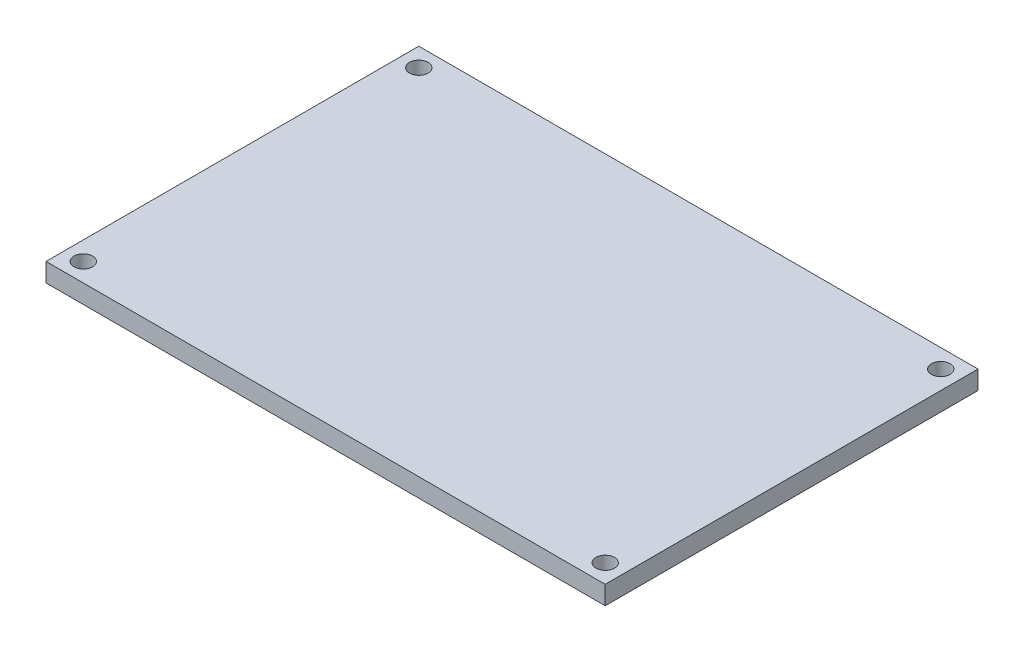
from build123d import *

# Parameters (mm, degrees)
SKETCH1_W           = 60
SKETCH1_H           = 40
BOSS_EXTRUDE1_DEPTH = 2
SKETCH2_R           = 1
CUT_EXTRUDE1_DEPTH  = 73.138755187


with BuildPart() as part:
    # Sketch1 → Boss-Extrude1 (new body)
    with BuildSketch(Plane(origin=(0, 0, 0), x_dir=(1, 0, 0), z_dir=(0, 1, 0))):
        with Locations((30, 20)):
            Rectangle(SKETCH1_W, SKETCH1_H)
    extrude(amount=BOSS_EXTRUDE1_DEPTH)

    # Sketch2 → Cut-Extrude1 (cut, through all)
    with BuildSketch(Plane(origin=(0, 2, 0), x_dir=(1, 0, 0), z_dir=(0, 1, 0))):
        with Locations(Location((2, 38, 0), (0, 0, 270))):
            Circle(SKETCH2_R)
        with Locations(Location((2, 2, 0), (0, 0, 270))):
            Circle(SKETCH2_R)
        with Locations(Location((58, 2, 0), (0, 0, 270))):
            Circle(SKETCH2_R)
        with Locations(Location((58, 38, 0), (0, 0, 270))):
            Circle(SKETCH2_R)
    extrude(amount=-CUT_EXTRUDE1_DEPTH, mode=Mode.SUBTRACT)


solid = part.part
